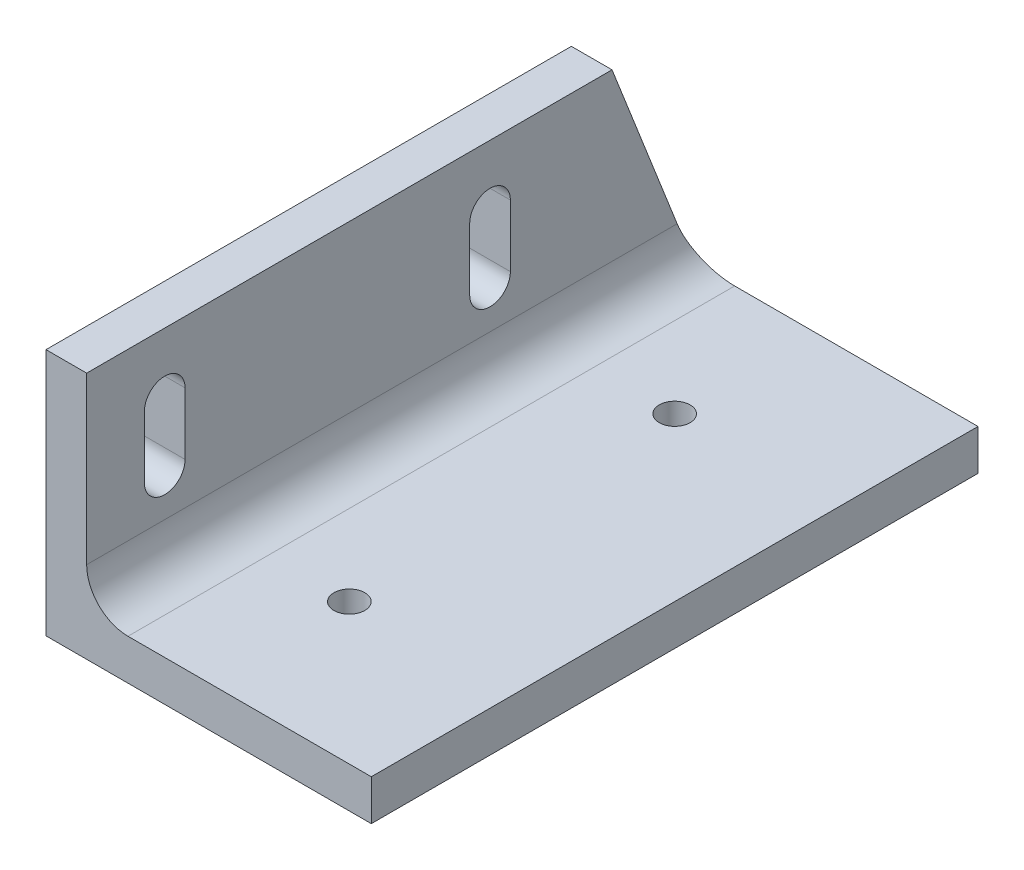
from build123d import *

# Parameters (mm, degrees)
BOSS_EXTRUDE1_DEPTH    = 74.6
CUT_EXTRUDE2_DEPTH     = 87.251900849
CUT_EXTRUDE3_DEPTH     = 10
FILLET1_R              = 5.08
F_10_24_TAPPED_HOLE1_D = 3.7973


with BuildPart() as part:
    # Sketch1 → Boss-Extrude1 (new body)
    with BuildSketch(Plane.XY):
        Polygon((0, 25.48), (0, 0), (35, 0), (35, -5), (-5, -5), (-5, 25.48), align=None)
    extrude(amount=BOSS_EXTRUDE1_DEPTH)

    # Sketch3 → Cut-Extrude2 (cut, through all)
    with BuildSketch(Plane(origin=(0, 0, 0), x_dir=(0, 0, -1), z_dir=(1, 0, 0))):
        with BuildLine():
            Line((-67.5, 10.24), (-67.5, 17.86))
            ThreePointArc((-67.5, 17.86), (-65, 20.36), (-62.5, 17.86))
            Line((-62.5, 17.86), (-62.5, 10.24))
            ThreePointArc((-62.5, 10.24), (-65, 7.74), (-67.5, 10.24))
        make_face()
        with BuildLine():
            Line((-27.5, 10.24), (-27.5, 17.86))
            ThreePointArc((-27.5, 17.86), (-25, 20.36), (-22.5, 17.86))
            Line((-22.5, 17.86), (-22.5, 10.24))
            ThreePointArc((-22.5, 10.24), (-25, 7.74), (-27.5, 10.24))
        make_face()
    extrude(amount=-CUT_EXTRUDE2_DEPTH, mode=Mode.SUBTRACT)

    # Sketch4 → Cut-Extrude3 (cut)
    with BuildSketch(Plane(origin=(0, 0, 0), x_dir=(0, 0, -1), z_dir=(1, 0, 0))):
        Polygon((-10, 25.48), (0, 0), (0, 25.48), align=None)
    extrude(amount=-CUT_EXTRUDE3_DEPTH, mode=Mode.SUBTRACT)

    # Fillet1
    fillet1_edges = [part.edges().sort_by_distance(p)[0] for p in [
        (0, 0, 37.3),
    ]]
    fillet(fillet1_edges, radius=FILLET1_R)

    # #10-24 Tapped Hole1 (through all)
    with Locations(Plane(origin=(0, 0, 0), x_dir=(1, 0, 0), z_dir=(0, 1, 0))):
        with Locations((15, -17.3), (15, -57.3)):
            Hole(F_10_24_TAPPED_HOLE1_D / 2)


solid = part.part
